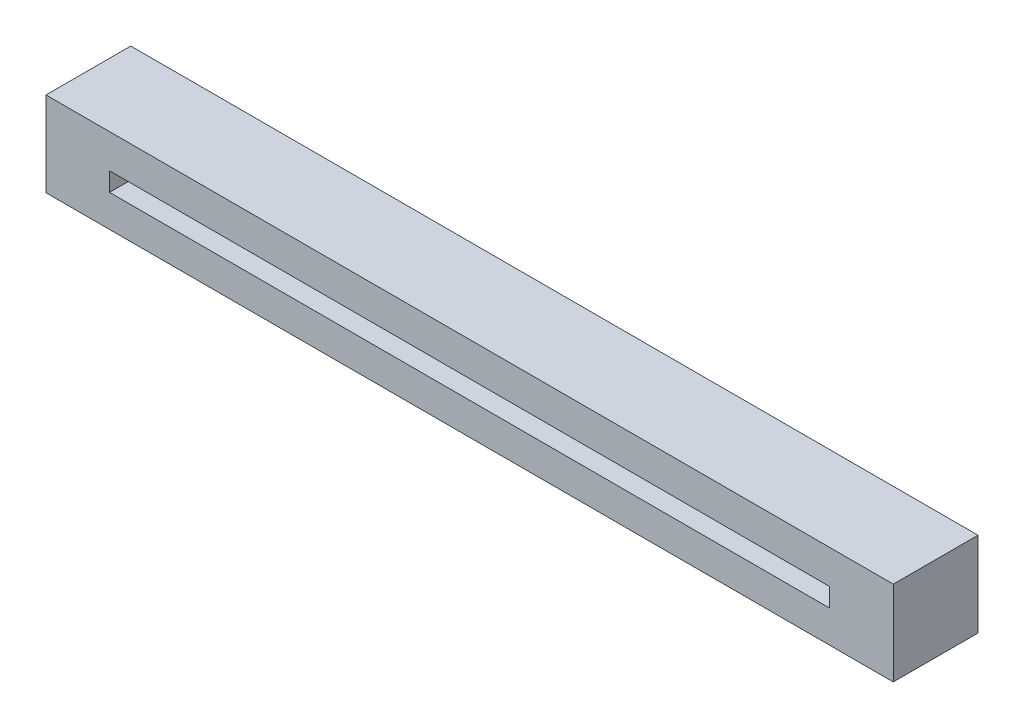
from build123d import *

# Parameters (mm, degrees)
SKETCH_1_W          = 120
SKETCH_1_H          = 12
EXTRUDE_2_DEPTH     = 12
SKETCH_4_W          = 102
SKETCH_4_H          = 2.650064188
CUT_EXTRUDE_2_DEPTH = 8


with BuildPart() as part:
    # 草图1 → 凸台-拉伸2 (new body)
    with BuildSketch(Plane.XY):
        with Locations((13.172413793, -28.344827586)):
            Rectangle(SKETCH_1_W, SKETCH_1_H)
    extrude(amount=EXTRUDE_2_DEPTH)

    # 草图4 → 切除-拉伸2 (cut)
    with BuildSketch(Plane.XY.offset(12)):
        with Locations((13.172413793, -28.46985968)):
            Rectangle(SKETCH_4_W, SKETCH_4_H)
    extrude(amount=-CUT_EXTRUDE_2_DEPTH, mode=Mode.SUBTRACT)


solid = part.part
